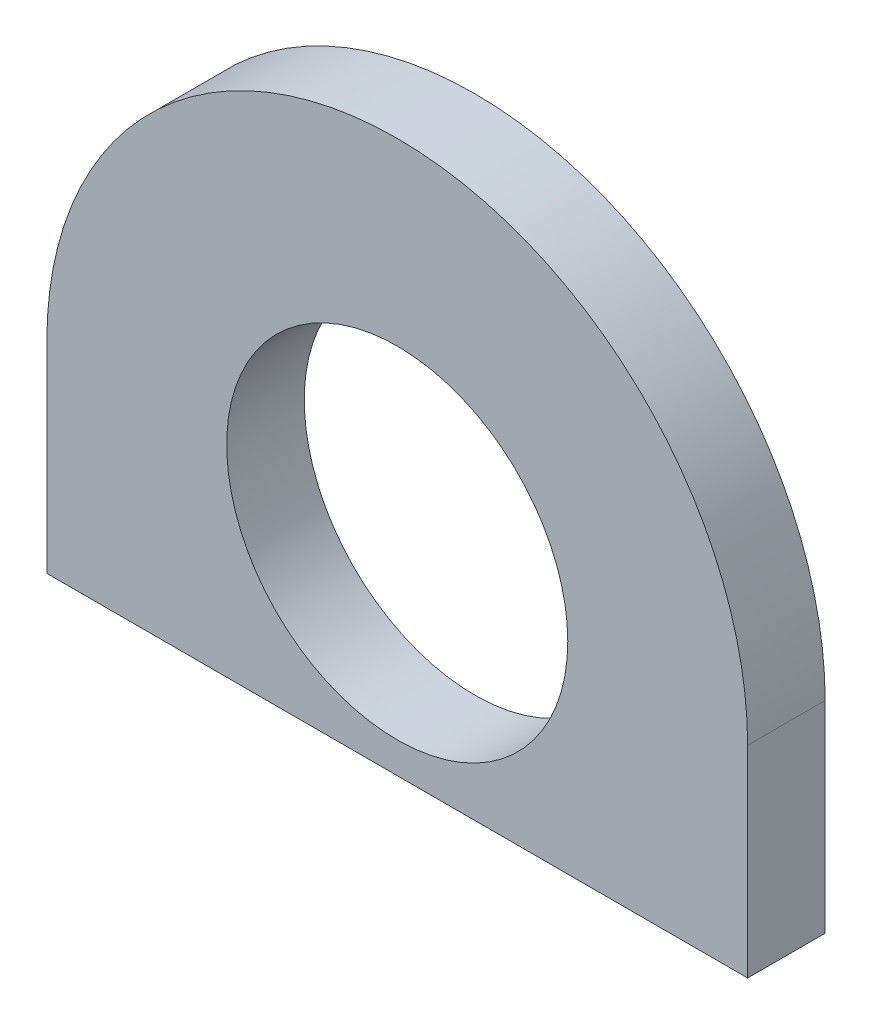
from build123d import *

# Parameters (mm, degrees)
SKETCH1_R           = 11
BOSS_EXTRUDE1_DEPTH = 5


with BuildPart() as part:
    # Sketch1 → Boss-Extrude1 (new body)
    with BuildSketch(Plane.XY):
        with BuildLine():
            Line((22.6, -13), (-22.6, -13))
            Line((-22.6, -13), (-22.6, 0))
            ThreePointArc((-22.6, 0), (0, 22.6), (22.6, 0))
            Line((22.6, 0), (22.6, -13))
        make_face()
        Circle(SKETCH1_R, mode=Mode.SUBTRACT)
    extrude(amount=BOSS_EXTRUDE1_DEPTH)


solid = part.part
